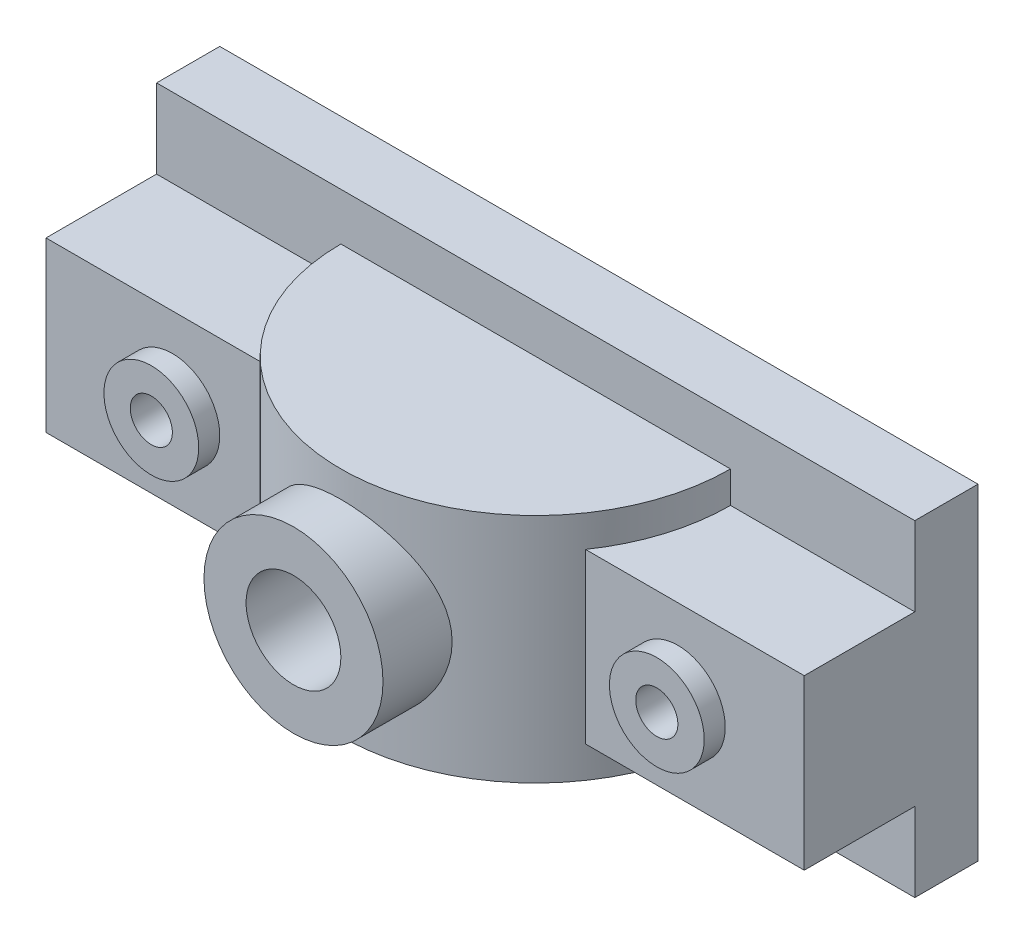
from build123d import *

# Parameters (mm, degrees)
SKETCH1_W               = 62
SKETCH1_H               = 144
BOSS_EXTRUDE1_DEPTH     = 12
REVOLVE1_ANGLE          = 180
BOSS_EXTRUDE2_START     = 25
SKETCH1_4_R             = 17
SKETCH1_4_R_2           = 9
BOSS_EXTRUDE2_DEPTH     = 21
SKETCH2_W               = 41.536907577
SKETCH2_H               = 21
BOSS_EXTRUDE3_DEPTH     = 16
SKETCH3_W               = 18
SKETCH3_H               = 13
CUT_EXTRUDE2_DEPTH      = 65
BOSS_EXTRUDE4_START     = 21
SKETCH1_5_R             = 9
SKETCH1_5_R_2           = 4
BOSS_EXTRUDE4_DEPTH     = 4
CUT_EXTRUDE3_DEPTH      = 91.89004351
CUT_EXTRUDE3_DEPTH_BACK = 91.89004351
SKETCH1_6_R             = 9
SKETCH1_6_R_2           = 4


with BuildPart() as part:
    # Sketch1 → Boss-Extrude1 (new body)
    with BuildSketch(Plane(origin=(0, 0, 0), x_dir=(0, 1, 0), z_dir=(0, 0, 1))):
        Rectangle(SKETCH1_W, SKETCH1_H)
        Polygon((13, -25), (9, -25), (9, -65), (-9, -65), (-9, -25), (-13, -25), (-13, 25), (-9, 25), (-9, 65), (9, 65), (9, 25), (13, 25), align=None, mode=Mode.SUBTRACT)
    extrude(amount=-BOSS_EXTRUDE1_DEPTH)

    # Sketch1<3> → Revolve1 (revolve)
    with BuildSketch(Plane(origin=(0, 0, 0), x_dir=(0, 1, 0), z_dir=(0, 0, 1))):
        with BuildLine():
            Line((-22, 0), (-22, -37))
            Line((-22, -37), (22, -37))
            Line((22, -37), (22, 0))
            Line((22, 0), (17, 0))
            ThreePointArc((17, 0), (15.968719423, -5.830951895), (13, -10.95445115))
            Line((13, -10.95445115), (13, -25))
            Line((13, -25), (-13, -25))
            Line((-13, -25), (-13, -10.95445115))
            ThreePointArc((-13, -10.95445115), (-15.968719423, -5.830951895), (-17, 0))
            Line((-17, 0), (-22, 0))
        make_face()
    revolve(axis=Axis((0, -69.170626614, 0), (0, -1, 0)), revolution_arc=REVOLVE1_ANGLE)

    # Sketch1<4> → Boss-Extrude2 (add)
    with BuildSketch(Plane(origin=(0, 0, 0), x_dir=(0, 1, 0), z_dir=(0, 0, 1)).offset(BOSS_EXTRUDE2_START)):
        Circle(SKETCH1_4_R)
        Circle(SKETCH1_4_R_2, mode=Mode.SUBTRACT)
    extrude(amount=BOSS_EXTRUDE2_DEPTH)

    # Sketch2 → Boss-Extrude3 (add, symmetric)
    with BuildSketch(Plane(origin=(0, 0, 0), x_dir=(-1, 0, 0), z_dir=(0, 1, 0))):
        with Locations((-51.231546212, 10.5)):
            Rectangle(SKETCH2_W, SKETCH2_H)
        with Locations((51.231546212, 10.5)):
            Rectangle(SKETCH2_W, SKETCH2_H)
    extrude(amount=BOSS_EXTRUDE3_DEPTH, both=True)

    # Sketch3 → Cut-Extrude2 (cut, symmetric)
    with BuildSketch(Plane.YZ):
        with Locations((0, 6.5)):
            Rectangle(SKETCH3_W, SKETCH3_H)
    extrude(amount=CUT_EXTRUDE2_DEPTH, both=True, mode=Mode.SUBTRACT)

    # Sketch1<5> → Boss-Extrude4 (add)
    # profile 1 of 2: a face of its own
    with BuildSketch(Plane(origin=(0, 0, 0), x_dir=(0, 1, 0), z_dir=(0, 0, 1)).offset(BOSS_EXTRUDE4_START)):
        with Locations((0, -48)):
            Circle(SKETCH1_5_R)
        with Locations((0, -48)):
            Circle(SKETCH1_5_R_2, mode=Mode.SUBTRACT)
    # profile 2 of 2: a face of its own
    with BuildSketch(Plane(origin=(0, 0, 0), x_dir=(0, 1, 0), z_dir=(0, 0, 1)).offset(BOSS_EXTRUDE4_START)):
        with Locations((0, 48)):
            Circle(SKETCH1_5_R)
        with Locations((0, 48)):
            Circle(SKETCH1_5_R_2, mode=Mode.SUBTRACT)
    extrude(amount=BOSS_EXTRUDE4_DEPTH)

    # Sketch1<6> → Cut-Extrude3 (cut, two sides: drawn at the far end of the back side and taken through both)
    with BuildSketch(Plane(origin=(0, 0, 0), x_dir=(0, 1, 0), z_dir=(0, 0, 1)).offset(-CUT_EXTRUDE3_DEPTH_BACK)):
        Circle(SKETCH1_6_R)
        with Locations((0, 48)):
            Circle(SKETCH1_6_R_2)
        with Locations((0, -48)):
            Circle(SKETCH1_6_R_2)
    extrude(amount=CUT_EXTRUDE3_DEPTH + CUT_EXTRUDE3_DEPTH_BACK, mode=Mode.SUBTRACT)


solid = part.part
